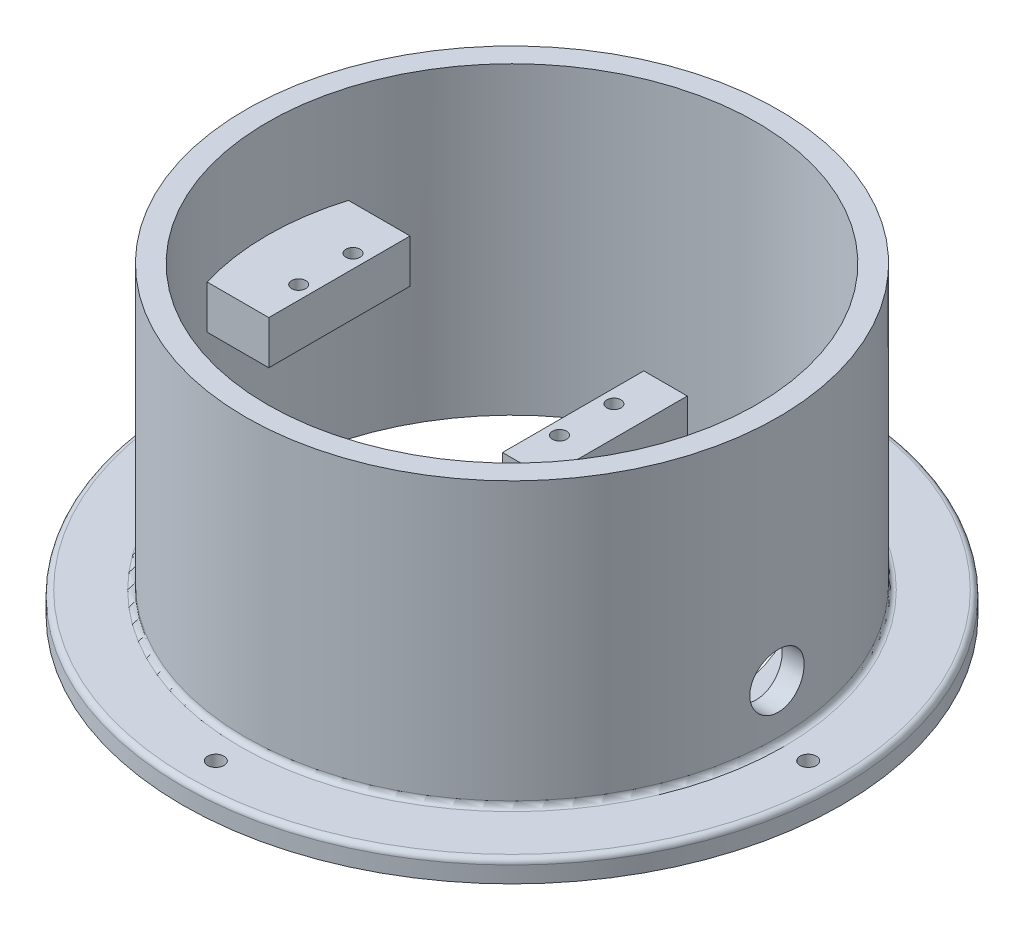
from build123d import *

# Parameters (mm, degrees)
SKETCH1_R           = 60.625
SKETCH1_R_2         = 45
BOSS_EXTRUDE1_DEPTH = 4
SKETCH2_R           = 49
SKETCH2_R_2         = 45
BOSS_EXTRUDE2_DEPTH = 52
SKETCH3_W           = 8
SKETCH3_H           = 38
SKETCH3_W_2         = 15
SKETCH3_H_2         = 8
BOSS_EXTRUDE3_DEPTH = 13
SKETCH4_W           = 10
SKETCH4_H           = 24
CUT_EXTRUDE1_DEPTH  = 8
SKETCH5_R           = 5
CUT_EXTRUDE2_DEPTH  = 110.441337026
SKETCH6_R           = 1.3
CUT_EXTRUDE3_DEPTH  = 7.2
BOSS_EXTRUDE4_DEPTH = 4
SKETCH8_R           = 1.5
CUT_EXTRUDE4_DEPTH  = 103.404986506
FILLET1_R           = 1
FILLET2_R           = 1


with BuildPart() as part:
    # Sketch1 → Boss-Extrude1 (new body)
    with BuildSketch(Plane(origin=(0, 0, 0), x_dir=(1, 0, 0), z_dir=(0, 1, 0))):
        with Locations(Location((0, 0, 0), (0, 0, 270))):
            Circle(SKETCH1_R)
        with Locations(Location((0, 0, 0), (0, 0, 270))):
            Circle(SKETCH1_R_2, mode=Mode.SUBTRACT)
    extrude(amount=BOSS_EXTRUDE1_DEPTH)

    # Sketch2 → Boss-Extrude2 (add)
    with BuildSketch(Plane(origin=(0, 4, 0), x_dir=(1, 0, 0), z_dir=(0, 1, 0))):
        with Locations(Location((0, 0, 0), (0, 0, 90))):
            Circle(SKETCH2_R)
        with Locations(Location((0, 0, 0), (0, 0, 270))):
            Circle(SKETCH2_R_2, mode=Mode.SUBTRACT)
    extrude(amount=BOSS_EXTRUDE2_DEPTH)

    # Sketch3 → Boss-Extrude3 (add, symmetric)
    with BuildSketch(Plane.XY):
        with Locations((15.25, 19)):
            Rectangle(SKETCH3_W, SKETCH3_H)
        with Locations((-39.25, 34)):
            Rectangle(SKETCH3_W_2, SKETCH3_H_2)
    extrude(amount=BOSS_EXTRUDE3_DEPTH, both=True)


with BuildPart() as boss_extrude3_piece_1:
    # of the separate pieces the step leaves, piece 1, a body of its own (boss_extrude3_pieces)
    add(part.part.solids().sort_by_distance((0, 0, 60.625))[0])

    # Sketch5 → Cut-Extrude2 (cut, through all)
    with BuildSketch(Plane.ZY.offset(-11.25)):
        with Locations((0, 14)):
            Circle(SKETCH5_R)
    extrude(amount=-CUT_EXTRUDE2_DEPTH, mode=Mode.SUBTRACT)


with BuildPart() as boss_extrude3_piece_2:
    # of the separate pieces the step leaves, piece 2, a body of its own (boss_extrude3_pieces)
    add(part.part.solids().sort_by_distance((11.25, 0, -13))[0])

    # Sketch4 → Cut-Extrude1 (cut)
    with BuildSketch(Plane.ZY.offset(-11.25)):
        with Locations((0, 17)):
            Rectangle(SKETCH4_W, SKETCH4_H)
    extrude(amount=-CUT_EXTRUDE1_DEPTH, mode=Mode.SUBTRACT)


with BuildPart() as cut_extrude3_tool:
    # Sketch6 → Cut-Extrude3 (new body)
    with BuildSketch(Plane(origin=(0, 38, 0), x_dir=(1, 0, 0), z_dir=(0, 1, 0))):
        with Locations(Location((-34.25, 5, 0), (0, 0, 270))):
            Circle(SKETCH6_R)
        with Locations(Location((-34.25, -5, 0), (0, 0, 270))):
            Circle(SKETCH6_R)
        with Locations(Location((13.75, 5, 0), (0, 0, 270))):
            Circle(SKETCH6_R)
        with Locations(Location((13.75, -5, 0), (0, 0, 270))):
            Circle(SKETCH6_R)
    extrude(amount=-CUT_EXTRUDE3_DEPTH)


with BuildPart() as boss_extrude3_piece_1_1:
    add(boss_extrude3_piece_1.part)

    # Cut-Extrude3: cut by cut_extrude3_tool
    add(cut_extrude3_tool.part, mode=Mode.SUBTRACT)



with BuildPart() as boss_extrude3_piece_2_1:
    add(boss_extrude3_piece_2.part)

    # Cut-Extrude3: cut by cut_extrude3_tool
    add(cut_extrude3_tool.part, mode=Mode.SUBTRACT)


with BuildPart() as boss_extrude3_piece_1_2:
    add(boss_extrude3_piece_1_1.part)

    add(boss_extrude3_piece_2_1.part)  # Boss-Extrude4 merges Boss-Extrude3 piece 2
    # Sketch7 → Boss-Extrude4 (add)
    with BuildSketch(Plane.XZ):
        with BuildLine():
            Line((11.25, 13), (25.249838503, 37.248431585))
            ThreePointArc((25.249838503, 37.248431585), (45, 0), (25.249838503, -37.248431585))
            Line((25.249838503, -37.248431585), (11.25, -13))
            Line((11.25, -13), (11.25, 13))
        make_face()
        with BuildLine():
            Line((24.25, 19.516660498), (27.361802413, 24.906460381))
            ThreePointArc((27.361802413, 24.906460381), (37, 0), (27.361802413, -24.906460381))
            Line((27.361802413, -24.906460381), (24.25, -19.516660498))
            Line((24.25, -19.516660498), (24.25, 19.516660498))
        make_face(mode=Mode.SUBTRACT)
    extrude(amount=-BOSS_EXTRUDE4_DEPTH)

    # Sketch8 → Cut-Extrude4 (cut, through all)
    with BuildSketch(Plane.XZ):
        with Locations(Location((54.5, 0, 0), (0, 0, 270))):
            Circle(SKETCH8_R)
        with Locations(Location((0, -54.5, 0), (0, 0, 270))):
            Circle(SKETCH8_R)
        with Locations(Location((-54.5, 0, 0), (0, 0, 270))):
            Circle(SKETCH8_R)
        with Locations(Location((0, 54.5, 0), (0, 0, 270))):
            Circle(SKETCH8_R)
    extrude(amount=-CUT_EXTRUDE4_DEPTH, mode=Mode.SUBTRACT)

    # Fillet1
    fillet1_edges = [boss_extrude3_piece_1_2.edges().sort_by_distance(p)[0] for p in [
        (0, 4, 49),
    ]]
    fillet(fillet1_edges, radius=FILLET1_R)

    # Fillet2
    fillet2_edges = [boss_extrude3_piece_1_2.edges().sort_by_distance(p)[0] for p in [
        (0, 4, -60.625),
    ]]
    fillet(fillet2_edges, radius=FILLET2_R)


solid = boss_extrude3_piece_1_2.part
